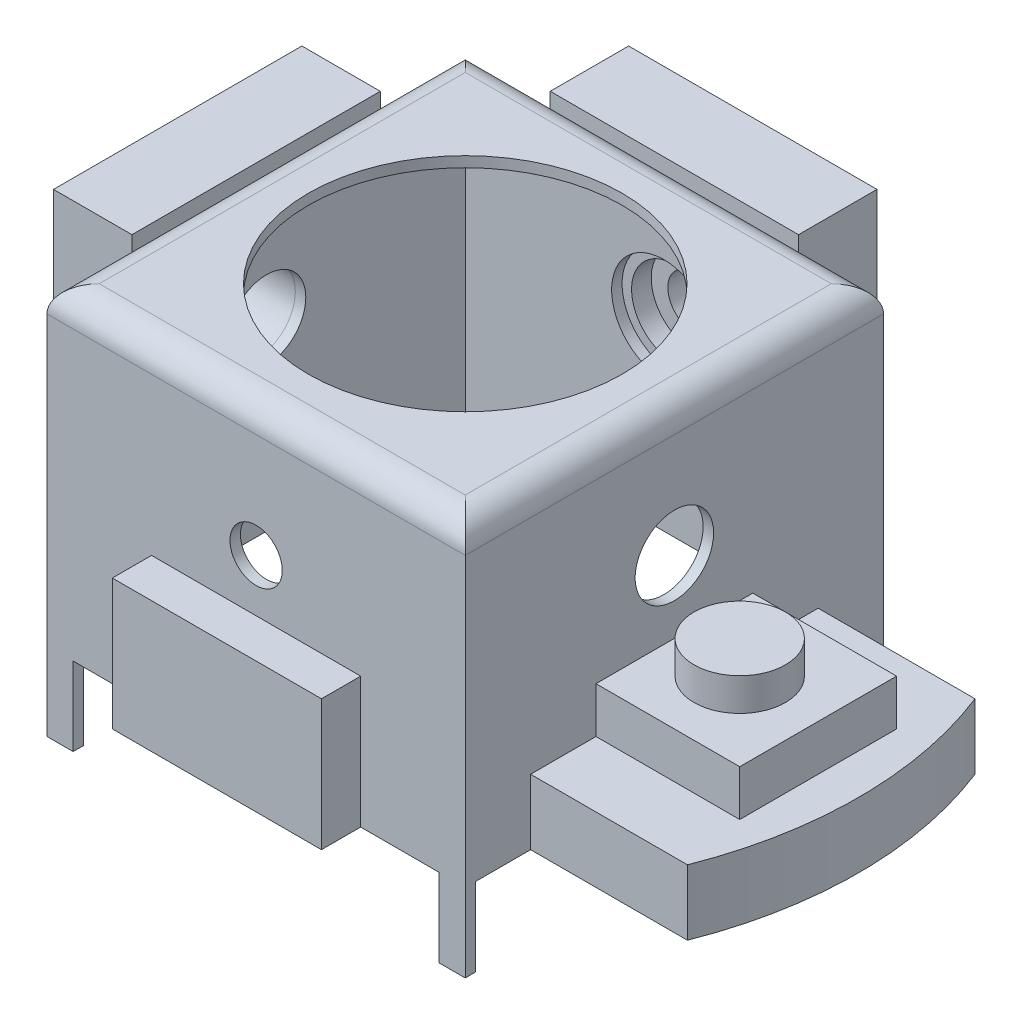
from build123d import *

# Parameters (mm, degrees)
SKETCH1_W            = 16
SKETCH1_H            = 16
EXTRUDE1_DEPTH       = 12
FILLET1_R            = 1
SHELL1_T             = -0.4
SKETCH2_R            = 6
EXTRUDE2_DEPTH       = 17.492422502
SKETCH4_W            = 8
SKETCH4_H            = 1.5
EXTRUDE3_DEPTH       = 5
EXTRUDE4_START       = 1
SKETCH5_W            = 3
SKETCH5_H            = 9.5
EXTRUDE4_DEPTH       = 11
EXTRUDE5_START       = 1
SKETCH6_W            = 9.5
SKETCH6_H            = 3
EXTRUDE5_DEPTH       = 11
EXTRUDE6_DEPTH       = 2.5
SKETCH8_W            = 5.5
SKETCH8_H            = 6
EXTRUDE7_DEPTH       = 1.75
SKETCH9_R            = 1.75
EXTRUDE8_DEPTH       = 1.25
EXTRUDE9_DEPTH       = 23.164160259
EXTRUDE9_DEPTH_BACK  = 23.164160259
SKETCH10_R           = 1
EXTRUDE10_DEPTH      = 23.164160259
EXTRUDE10_DEPTH_BACK = 23.164160259
SKETCH11_R           = 1
SKETCH12_W           = 1
SKETCH12_H           = 0.4
EXTRUDE11_DEPTH      = 3
SKETCH13_R           = 1.5
EXTRUDE12_DEPTH      = 0.4
SKETCH14_R           = 1.5
EXTRUDE13_DEPTH      = 0.4
SKETCH15_R           = 1.5
CUT_EXTRUDE1_DEPTH   = 1.75
SKETCH17_R           = 1.6375
CUT_EXTRUDE2_DEPTH   = 0.75
SKETCH18_R           = 1.5
CUT_EXTRUDE3_DEPTH   = 0.4
SKETCH19_R           = 2
EXTRUDE14_DEPTH      = 0.4


with BuildPart() as part:
    # Sketch1 → Extrude1 (new body)
    with BuildSketch(Plane(origin=(0, 0, 0), x_dir=(1, 0, 0), z_dir=(0, 1, 0))):
        Rectangle(SKETCH1_W, SKETCH1_H)
    extrude(amount=EXTRUDE1_DEPTH)

    # Fillet1
    fillet1_edges = [part.edges().sort_by_distance(p)[0] for p in [
        (-8, 12, 0),
        (0, 12, 8),
        (8, 12, 0),
        (0, 12, -8),
    ]]
    fillet(fillet1_edges, radius=FILLET1_R)

    # Shell1
    shell1_openings = [part.faces().sort_by_distance(p)[0] for p in [
        (0, 0, 0),
    ]]
    offset(amount=SHELL1_T, openings=shell1_openings)

    # Sketch2 → Extrude2 (cut, through all)
    with BuildSketch(Plane(origin=(0, 12, 0), x_dir=(1, 0, 0), z_dir=(0, 1, 0))):
        with Locations(Location((0, 0, 0), (0, 0, 270))):
            Circle(SKETCH2_R)
    extrude(amount=-EXTRUDE2_DEPTH, mode=Mode.SUBTRACT)


with BuildPart() as body_2:
    # Sketch4 → Extrude3 (new body)
    with BuildSketch(Plane(origin=(0, 0, 0), x_dir=(1, 0, 0), z_dir=(0, 1, 0))):
        with Locations((0, -8.75)):
            Rectangle(SKETCH4_W, SKETCH4_H)
    extrude(amount=EXTRUDE3_DEPTH)


with BuildPart() as body_3:
    # Sketch5 → Extrude4 (new body)
    with BuildSketch(Plane(origin=(0, 0, 0), x_dir=(1, 0, 0), z_dir=(0, 1, 0)).offset(EXTRUDE4_START)):
        with Locations((-9.5, 0)):
            Rectangle(SKETCH5_W, SKETCH5_H)
    extrude(amount=EXTRUDE4_DEPTH)


with BuildPart() as body_4:
    # Sketch6 → Extrude5 (new body)
    with BuildSketch(Plane(origin=(0, 0, 0), x_dir=(1, 0, 0), z_dir=(0, 1, 0)).offset(EXTRUDE5_START)):
        with Locations((0, 9.5)):
            Rectangle(SKETCH6_W, SKETCH6_H)
    extrude(amount=EXTRUDE5_DEPTH)


with BuildPart() as body_5:
    # Sketch7 → Extrude6 (new body)
    with BuildSketch(Plane(origin=(0, 0, 0), x_dir=(1, 0, 0), z_dir=(0, 1, 0))):
        with BuildLine():
            Line((8, 5.5), (14, 5.5))
            ThreePointArc((14, 5.5), (15.041608956, 0), (14, -5.5))
            Line((14, -5.5), (8, -5.5))
            Line((8, -5.5), (8, 5.5))
        make_face()
    extrude(amount=EXTRUDE6_DEPTH)


with BuildPart() as body_6:
    # Sketch8 → Extrude7 (new body)
    with BuildSketch(Plane(origin=(0, 2.5, 0), x_dir=(1, 0, 0), z_dir=(0, 1, 0))):
        with Locations((10.75, 0)):
            Rectangle(SKETCH8_W, SKETCH8_H)
    extrude(amount=EXTRUDE7_DEPTH)

    # Sketch9 → Extrude8 (add)
    with BuildSketch(Plane(origin=(0, 4.25, 0), x_dir=(1, 0, 0), z_dir=(0, 1, 0))):
        with Locations(Location((10.5, 0, 0), (0, 0, 270))):
            Circle(SKETCH9_R)
    extrude(amount=EXTRUDE8_DEPTH)


with BuildPart() as extrude9_tool:
    # Sketch10 → Extrude9 (new, two sides: drawn at the far end of the back side and taken through both)
    with BuildSketch(Plane.XY.offset(-EXTRUDE9_DEPTH_BACK)):
        with Locations((0, 7)):
            Circle(SKETCH10_R)
    extrude(amount=EXTRUDE9_DEPTH + EXTRUDE9_DEPTH_BACK)


with BuildPart() as part_1:
    add(part.part)

    # Extrude9: cut by extrude9_tool
    add(extrude9_tool.part, mode=Mode.SUBTRACT)


with BuildPart() as body_4_1:
    add(body_4.part)

    # Extrude9: cut by extrude9_tool
    add(extrude9_tool.part, mode=Mode.SUBTRACT)

    # Sketch17 → Cut-Extrude2 (cut)
    with BuildSketch(Plane.XY.offset(-8)):
        with Locations((0, 7)):
            Circle(SKETCH17_R)
    extrude(amount=-CUT_EXTRUDE2_DEPTH, mode=Mode.SUBTRACT)


with BuildPart() as extrude10_tool:
    # Sketch11 → Extrude10 (new, two sides: drawn at the far end of the back side and taken through both)
    with BuildSketch(Plane(origin=(0, 0, 0), x_dir=(0, 0, -1), z_dir=(1, 0, 0)).offset(-EXTRUDE10_DEPTH_BACK)):
        with Locations((0, 7)):
            Circle(SKETCH11_R)
    extrude(amount=EXTRUDE10_DEPTH + EXTRUDE10_DEPTH_BACK)


with BuildPart() as part_2:
    add(part_1.part)

    # Extrude10: cut by extrude10_tool
    add(extrude10_tool.part, mode=Mode.SUBTRACT)

    # Sketch12 → Extrude11 (add)
    with BuildSketch(Plane(origin=(0, 0, 0), x_dir=(1, 0, 0), z_dir=(0, 1, 0))):
        with Locations((7.5, 7.8)):
            Rectangle(SKETCH12_W, SKETCH12_H)
        with Locations((-7.5, 7.8)):
            Rectangle(SKETCH12_W, SKETCH12_H)
        with Locations((7.5, -7.8)):
            Rectangle(SKETCH12_W, SKETCH12_H)
        with Locations((-7.5, -7.8)):
            Rectangle(SKETCH12_W, SKETCH12_H)
    extrude(amount=-EXTRUDE11_DEPTH)

    # Sketch13 → Extrude12 (cut)
    with BuildSketch(Plane.XY.offset(-7.6)):
        with Locations((0, 7)):
            Circle(SKETCH13_R)
    extrude(amount=-EXTRUDE12_DEPTH, mode=Mode.SUBTRACT)

    # Sketch14 → Extrude13 (cut)
    with BuildSketch(Plane(origin=(-7.6, 0, 0), x_dir=(0, 0, -1), z_dir=(1, 0, 0))):
        with Locations((0, 7)):
            Circle(SKETCH14_R)
    extrude(amount=-EXTRUDE13_DEPTH, mode=Mode.SUBTRACT)

    # Sketch18 → Cut-Extrude3 (cut)
    with BuildSketch(Plane(origin=(8, 0, 0), x_dir=(0, 0, -1), z_dir=(1, 0, 0))):
        with Locations((0, 7)):
            Circle(SKETCH18_R)
    extrude(amount=-CUT_EXTRUDE3_DEPTH, mode=Mode.SUBTRACT)

    # Sketch19 → Extrude14 (cut)
    with BuildSketch(Plane.XY.offset(-7.6)):
        with Locations((0, 7)):
            Circle(SKETCH19_R)
    extrude(amount=-EXTRUDE14_DEPTH, mode=Mode.SUBTRACT)


with BuildPart() as body_3_1:
    add(body_3.part)

    # Extrude10: cut by extrude10_tool
    add(extrude10_tool.part, mode=Mode.SUBTRACT)

    # Sketch15 → Cut-Extrude1 (cut)
    with BuildSketch(Plane(origin=(-8, 0, 0), x_dir=(0, 0, -1), z_dir=(1, 0, 0))):
        with Locations((0, 7)):
            Circle(SKETCH15_R)
    extrude(amount=-CUT_EXTRUDE1_DEPTH, mode=Mode.SUBTRACT)


solid = Compound([body_2.part, body_5.part, body_6.part, body_4_1.part, part_2.part, body_3_1.part])
